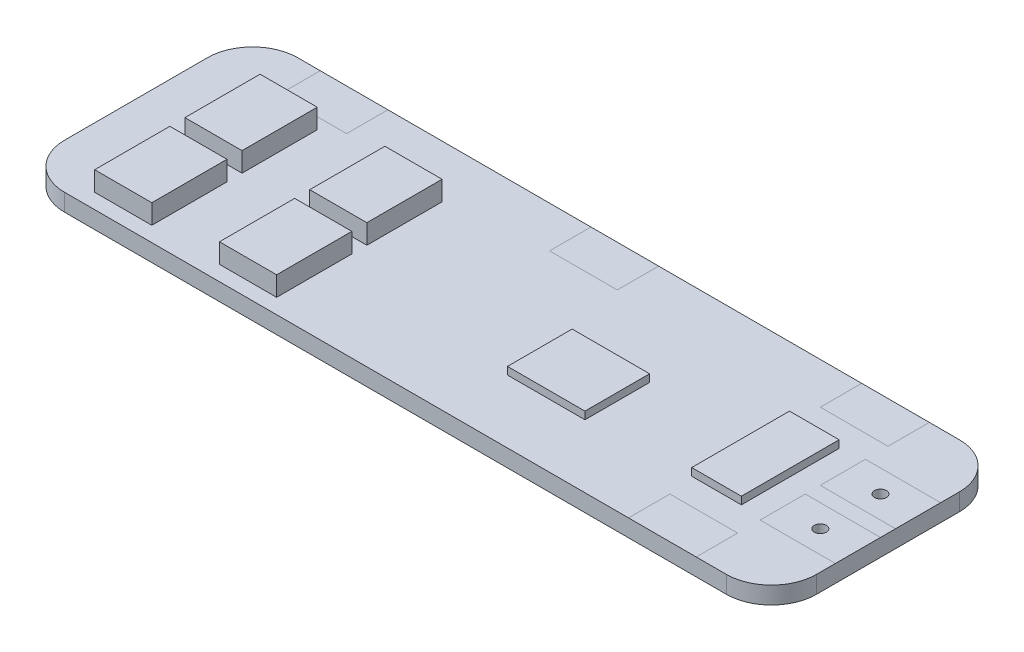
from build123d import *

# Parameters (mm, degrees)
CROQUIS1_R                = 0.4
SALIENTE_EXTRUIR1_DEPTH   = 1.15
CROQUIS2_W                = 3.8
CROQUIS2_H                = 5
SALIENTE_EXTRUIR2_DEPTH   = 1.3
SALIENTE_EXTRUIR2_2_DEPTH = 1.3
SALIENTE_EXTRUIR2_3_DEPTH = 1.3
SALIENTE_EXTRUIR2_4_DEPTH = 1.3
CROQUIS3_W                = 5.15
CROQUIS3_H                = 4.3
SALIENTE_EXTRUIR3_DEPTH   = 0.5
CROQUIS3_W_2              = 3.3
CROQUIS3_H_2              = 6.5
SALIENTE_EXTRUIR3_2_DEPTH = 0.5


with BuildPart() as part:
    # Croquis1 → Saliente-Extruir1 (new body)
    with BuildSketch(Plane(origin=(0, 0, 0), x_dir=(1, 0, 0), z_dir=(0, 1, 0))):
        with BuildLine():
            Line((-22, 7.75), (22, 7.75))
            ThreePointArc((22, 7.75), (24.121320344, 6.871320344), (25, 4.75))
            Line((25, 4.75), (25, -4.75))
            ThreePointArc((25, -4.75), (24.121320344, -6.871320344), (22, -7.75))
            Line((22, -7.75), (-22, -7.75))
            ThreePointArc((-22, -7.75), (-24.121320344, -6.871320344), (-25, -4.75))
            Line((-25, -4.75), (-25, 4.75))
            ThreePointArc((-25, 4.75), (-24.121320344, 6.871320344), (-22, 7.75))
        make_face()
        with Locations(Location((22.5, 2, 0), (0, 0, 270))):
            Circle(CROQUIS1_R, mode=Mode.SUBTRACT)
        with Locations(Location((22.5, -2, 0), (0, 0, 90))):
            Circle(CROQUIS1_R, mode=Mode.SUBTRACT)
    extrude(amount=SALIENTE_EXTRUIR1_DEPTH)


with BuildPart() as body_2:
    # Croquis2 → Saliente-Extruir2 (new body)
    with BuildSketch(Plane(origin=(0, 1.15, 0), x_dir=(1, 0, 0), z_dir=(0, 1, 0))):
        with Locations((-19.1, 1.75)):
            Rectangle(CROQUIS2_W, CROQUIS2_H)
    extrude(amount=SALIENTE_EXTRUIR2_DEPTH)


with BuildPart() as body_3:
    # Croquis2 → Saliente-Extruir2 2 (new body)
    with BuildSketch(Plane(origin=(0, 1.15, 0), x_dir=(1, 0, 0), z_dir=(0, 1, 0))):
        with Locations((-10.8, 1.75)):
            Rectangle(CROQUIS2_W, CROQUIS2_H)
    extrude(amount=SALIENTE_EXTRUIR2_2_DEPTH)


with BuildPart() as body_4:
    # Croquis2 → Saliente-Extruir2 3 (new body)
    with BuildSketch(Plane(origin=(0, 1.15, 0), x_dir=(1, 0, 0), z_dir=(0, 1, 0))):
        with Locations((-10.8, -4.25)):
            Rectangle(CROQUIS2_W, CROQUIS2_H)
    extrude(amount=SALIENTE_EXTRUIR2_3_DEPTH)


with BuildPart() as body_5:
    # Croquis2 → Saliente-Extruir2 4 (new body)
    with BuildSketch(Plane(origin=(0, 1.15, 0), x_dir=(1, 0, 0), z_dir=(0, 1, 0))):
        with Locations((-19.1, -4.25)):
            Rectangle(CROQUIS2_W, CROQUIS2_H)
    extrude(amount=SALIENTE_EXTRUIR2_4_DEPTH)


with BuildPart() as body_6:
    # Croquis3 → Saliente-Extruir3 (new body)
    with BuildSketch(Plane(origin=(0, 1.15, 0), x_dir=(1, 0, 0), z_dir=(0, 1, 0))):
        with Locations((5.825, -1.4)):
            Rectangle(CROQUIS3_W, CROQUIS3_H)
    extrude(amount=SALIENTE_EXTRUIR3_DEPTH)


with BuildPart() as body_7:
    # Croquis3 → Saliente-Extruir3 2 (new body)
    with BuildSketch(Plane(origin=(0, 1.15, 0), x_dir=(1, 0, 0), z_dir=(0, 1, 0))):
        with Locations((16.85, 0)):
            Rectangle(CROQUIS3_W_2, CROQUIS3_H_2)
    extrude(amount=SALIENTE_EXTRUIR3_2_DEPTH)


solid = Compound([part.part, body_2.part, body_3.part, body_4.part, body_5.part, body_6.part, body_7.part])
